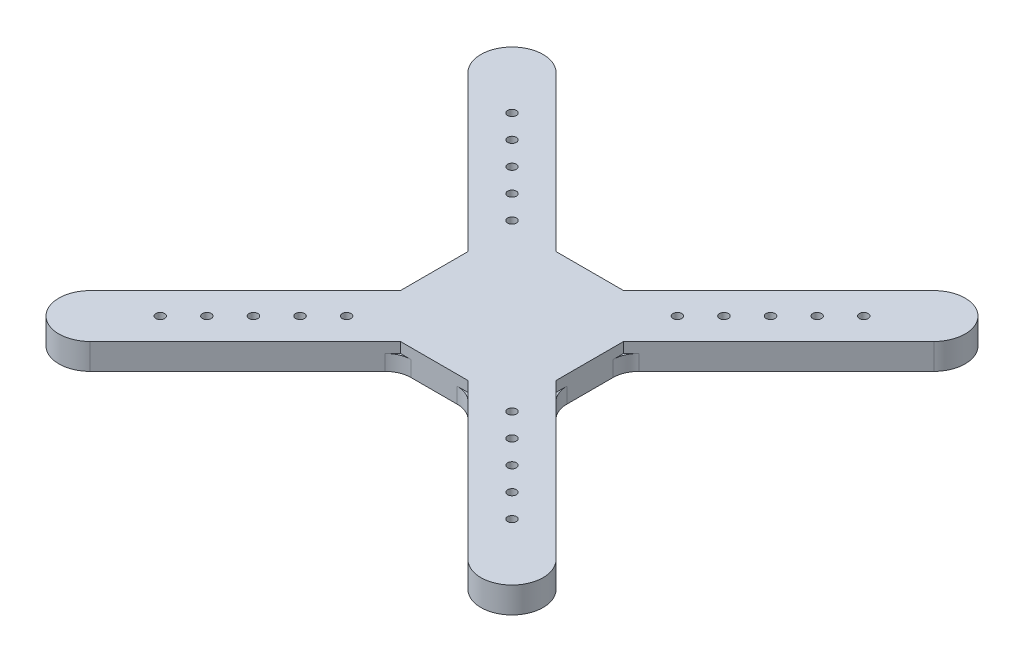
from build123d import *

# Parameters (mm, degrees)
SKETCH1_R           = 1.7
BOSS_EXTRUDE1_DEPTH = 6
FILLET1_R           = 10
SKETCH1_4_R         = 1.7
BOSS_EXTRUDE2_DEPTH = 10


with BuildPart() as part:
    # Sketch1 → Boss-Extrude1 (new body)
    with BuildSketch(Plane(origin=(0, 0, 0), x_dir=(1, 0, 0), z_dir=(0, 1, 0))):
        with BuildLine():
            Line((-72.831998462, 89.802561211), (-13.029437252, 30))
            Line((-13.029437252, 30), (13.029437252, 30))
            Line((13.029437252, 30), (72.831998462, 89.802561211))
            ThreePointArc((72.831998462, 89.802561211), (89.802561211, 89.802561211), (89.802561211, 72.831998462))
            Line((89.802561211, 72.831998462), (30, 13.029437252))
            Line((30, 13.029437252), (30, -13.029437252))
            Line((30, -13.029437252), (89.802561211, -72.831998462))
            ThreePointArc((89.802561211, -72.831998462), (89.802561211, -89.802561211), (72.831998462, -89.802561211))
            Line((72.831998462, -89.802561211), (13.029437252, -30))
            Line((13.029437252, -30), (-13.029437252, -30))
            Line((-13.029437252, -30), (-72.831998462, -89.802561211))
            ThreePointArc((-72.831998462, -89.802561211), (-89.802561211, -89.802561211), (-89.802561211, -72.831998462))
            Line((-89.802561211, -72.831998462), (-30, -13.029437252))
            Line((-30, -13.029437252), (-30, 13.029437252))
            Line((-30, 13.029437252), (-89.802561211, 72.831998462))
            ThreePointArc((-89.802561211, 72.831998462), (-89.802561211, 89.802561211), (-72.831998462, 89.802561211))
        make_face()
        with Locations((67.787488849, 67.787488849)):
            Circle(SKETCH1_R, mode=Mode.SUBTRACT)
        with Locations((58.807232728, 58.807232728)):
            Circle(SKETCH1_R, mode=Mode.SUBTRACT)
        with Locations((49.826976607, 49.826976607)):
            Circle(SKETCH1_R, mode=Mode.SUBTRACT)
        with Locations((40.846720486, 40.846720486)):
            Circle(SKETCH1_R, mode=Mode.SUBTRACT)
        with Locations((31.866464365, 31.866464365)):
            Circle(SKETCH1_R, mode=Mode.SUBTRACT)
        with Locations((67.787488849, -67.787488849)):
            Circle(SKETCH1_R, mode=Mode.SUBTRACT)
        with Locations((58.807232728, -58.807232728)):
            Circle(SKETCH1_R, mode=Mode.SUBTRACT)
        with Locations((49.826976607, -49.826976607)):
            Circle(SKETCH1_R, mode=Mode.SUBTRACT)
        with Locations((40.846720486, -40.846720486)):
            Circle(SKETCH1_R, mode=Mode.SUBTRACT)
        with Locations((31.866464365, -31.866464365)):
            Circle(SKETCH1_R, mode=Mode.SUBTRACT)
        with Locations((-67.787488849, 67.787488849)):
            Circle(SKETCH1_R, mode=Mode.SUBTRACT)
        with Locations((-58.807232728, 58.807232728)):
            Circle(SKETCH1_R, mode=Mode.SUBTRACT)
        with Locations((-31.866464365, 31.866464365)):
            Circle(SKETCH1_R, mode=Mode.SUBTRACT)
        with Locations((-49.826976607, 49.826976607)):
            Circle(SKETCH1_R, mode=Mode.SUBTRACT)
        with Locations((-40.846720486, 40.846720486)):
            Circle(SKETCH1_R, mode=Mode.SUBTRACT)
        with Locations((-31.866464365, -31.866464365)):
            Circle(SKETCH1_R, mode=Mode.SUBTRACT)
        with Locations((-58.807232728, -58.807232728)):
            Circle(SKETCH1_R, mode=Mode.SUBTRACT)
        with Locations((-40.846720486, -40.846720486)):
            Circle(SKETCH1_R, mode=Mode.SUBTRACT)
        with Locations((-49.826976607, -49.826976607)):
            Circle(SKETCH1_R, mode=Mode.SUBTRACT)
        with Locations((-67.787488849, -67.787488849)):
            Circle(SKETCH1_R, mode=Mode.SUBTRACT)
    extrude(amount=BOSS_EXTRUDE1_DEPTH)

    # Fillet1
    fillet1_edges = [part.edges().sort_by_distance(p)[0] for p in [
        (-30, 3, -13.029437252),
        (-30, 3, 13.029437252),
        (-13.029437252, 3, -30),
        (13.029437252, 3, -30),
        (30, 3, 13.029437252),
        (30, 3, -13.029437252),
        (13.029437252, 3, 30),
        (-13.029437252, 3, 30),
    ]]
    fillet(fillet1_edges, radius=FILLET1_R)

    # Sketch1<4> → Boss-Extrude2 (add)
    with BuildSketch(Plane(origin=(0, 0, 0), x_dir=(1, 0, 0), z_dir=(0, 1, 0))):
        with BuildLine():
            Line((-72.831998462, 89.802561211), (-13.029437252, 30))
            Line((-13.029437252, 30), (13.029437252, 30))
            Line((13.029437252, 30), (72.831998462, 89.802561211))
            ThreePointArc((72.831998462, 89.802561211), (89.802561211, 89.802561211), (89.802561211, 72.831998462))
            Line((89.802561211, 72.831998462), (30, 13.029437252))
            Line((30, 13.029437252), (30, -13.029437252))
            Line((30, -13.029437252), (89.802561211, -72.831998462))
            ThreePointArc((89.802561211, -72.831998462), (89.802561211, -89.802561211), (72.831998462, -89.802561211))
            Line((72.831998462, -89.802561211), (13.029437252, -30))
            Line((13.029437252, -30), (-13.029437252, -30))
            Line((-13.029437252, -30), (-72.831998462, -89.802561211))
            ThreePointArc((-72.831998462, -89.802561211), (-89.802561211, -89.802561211), (-89.802561211, -72.831998462))
            Line((-89.802561211, -72.831998462), (-30, -13.029437252))
            Line((-30, -13.029437252), (-30, 13.029437252))
            Line((-30, 13.029437252), (-89.802561211, 72.831998462))
            ThreePointArc((-89.802561211, 72.831998462), (-89.802561211, 89.802561211), (-72.831998462, 89.802561211))
        make_face()
        with Locations((67.787488849, 67.787488849)):
            Circle(SKETCH1_4_R, mode=Mode.SUBTRACT)
        with Locations((58.807232728, 58.807232728)):
            Circle(SKETCH1_4_R, mode=Mode.SUBTRACT)
        with Locations((49.826976607, 49.826976607)):
            Circle(SKETCH1_4_R, mode=Mode.SUBTRACT)
        with Locations((40.846720486, 40.846720486)):
            Circle(SKETCH1_4_R, mode=Mode.SUBTRACT)
        with Locations((31.866464365, 31.866464365)):
            Circle(SKETCH1_4_R, mode=Mode.SUBTRACT)
        with Locations((67.787488849, -67.787488849)):
            Circle(SKETCH1_4_R, mode=Mode.SUBTRACT)
        with Locations((58.807232728, -58.807232728)):
            Circle(SKETCH1_4_R, mode=Mode.SUBTRACT)
        with Locations((49.826976607, -49.826976607)):
            Circle(SKETCH1_4_R, mode=Mode.SUBTRACT)
        with Locations((40.846720486, -40.846720486)):
            Circle(SKETCH1_4_R, mode=Mode.SUBTRACT)
        with Locations((31.866464365, -31.866464365)):
            Circle(SKETCH1_4_R, mode=Mode.SUBTRACT)
        with Locations((-67.787488849, 67.787488849)):
            Circle(SKETCH1_4_R, mode=Mode.SUBTRACT)
        with Locations((-58.807232728, 58.807232728)):
            Circle(SKETCH1_4_R, mode=Mode.SUBTRACT)
        with Locations((-31.866464365, 31.866464365)):
            Circle(SKETCH1_4_R, mode=Mode.SUBTRACT)
        with Locations((-49.826976607, 49.826976607)):
            Circle(SKETCH1_4_R, mode=Mode.SUBTRACT)
        with Locations((-40.846720486, 40.846720486)):
            Circle(SKETCH1_4_R, mode=Mode.SUBTRACT)
        with Locations((-31.866464365, -31.866464365)):
            Circle(SKETCH1_4_R, mode=Mode.SUBTRACT)
        with Locations((-58.807232728, -58.807232728)):
            Circle(SKETCH1_4_R, mode=Mode.SUBTRACT)
        with Locations((-40.846720486, -40.846720486)):
            Circle(SKETCH1_4_R, mode=Mode.SUBTRACT)
        with Locations((-49.826976607, -49.826976607)):
            Circle(SKETCH1_4_R, mode=Mode.SUBTRACT)
        with Locations((-67.787488849, -67.787488849)):
            Circle(SKETCH1_4_R, mode=Mode.SUBTRACT)
    extrude(amount=BOSS_EXTRUDE2_DEPTH)


solid = part.part
